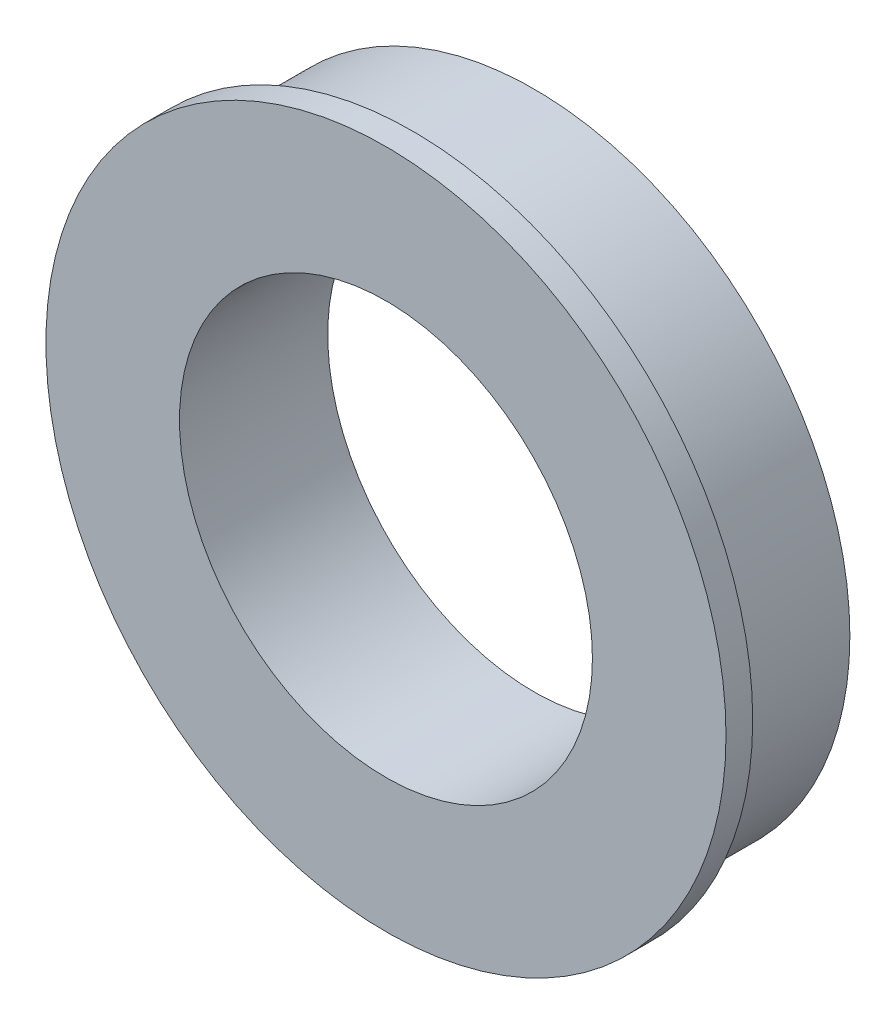
from build123d import *

# Parameters (mm, degrees)
SKETCH_1_R      = 13
SKETCH_1_R_2    = 8.5
EXTRUDE_1_DEPTH = 5
SKETCH_2_R      = 14
SKETCH_2_R_2    = 8.5
EXTRUDE_2_DEPTH = 1.1


with BuildPart() as part:
    # 草图1 → 凸台-拉伸1 (new body)
    with BuildSketch(Plane.XY):
        Circle(SKETCH_1_R)
        Circle(SKETCH_1_R_2, mode=Mode.SUBTRACT)
    extrude(amount=EXTRUDE_1_DEPTH)

    # 草图2 → 凸台-拉伸2 (add)
    with BuildSketch(Plane.XY.offset(5)):
        Circle(SKETCH_2_R)
        Circle(SKETCH_2_R_2, mode=Mode.SUBTRACT)
    extrude(amount=EXTRUDE_2_DEPTH)


solid = part.part
